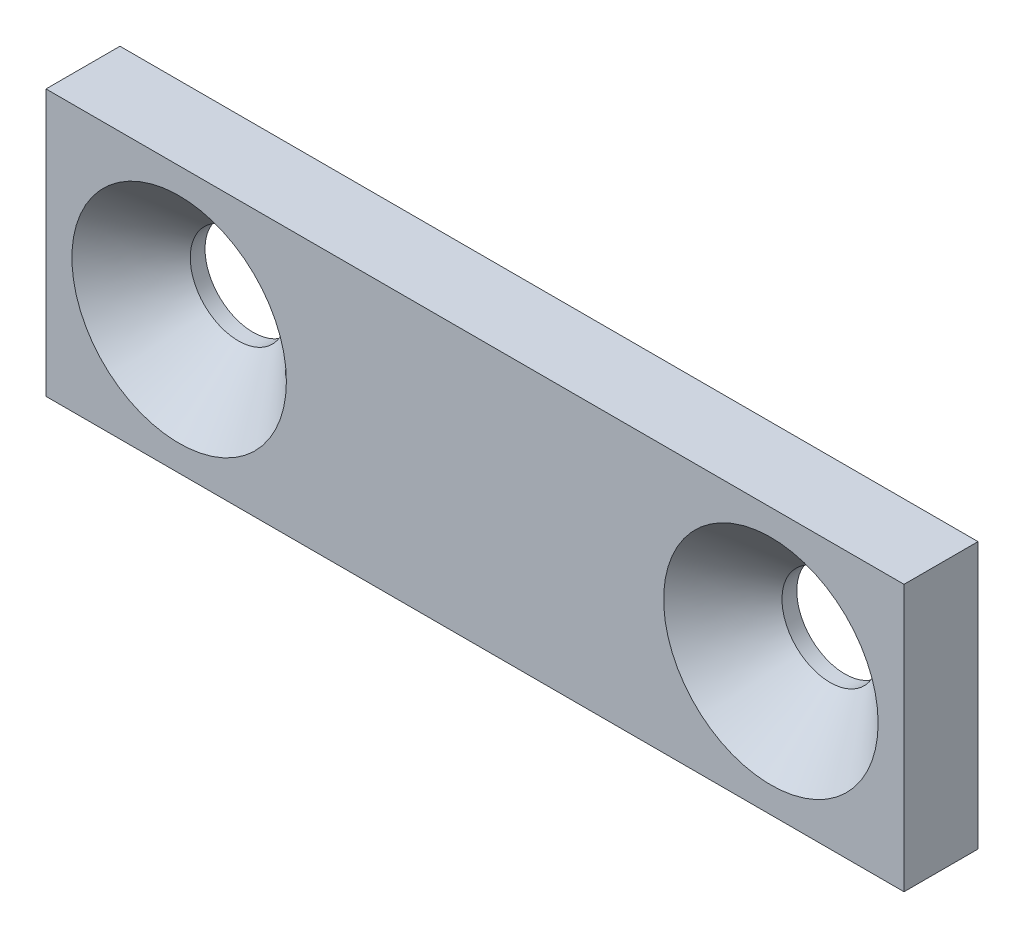
from build123d import *

# Parameters (mm, degrees)
ESQUISSE1_W                = 58
ESQUISSE1_H                = 18
BOSS_EXTRU_1_DEPTH         = 5
R_P_TITION_LIN_AIRE1_COUNT = 2
R_P_TITION_LIN_AIRE1_PITCH = 40


with BuildPart() as part:
    # Esquisse1 → Boss.-Extru.1 (new body)
    with BuildSketch(Plane.XY):
        Rectangle(ESQUISSE1_W, ESQUISSE1_H)
    extrude(amount=BOSS_EXTRU_1_DEPTH)

    # Esquisse3 → Fraisage pour vis à tête fraisée à 6 pans creux M61 (revolve, cut)
    with BuildSketch(Plane(origin=(20, 0, 5), x_dir=(0, -1, 0), z_dir=(1, 0, 0))):
        Polygon((0, 0), (0, 5), (3.25, 5), (3.25, 4), (7.25, 0), align=None)
    fraisage_pour_vis_t_te_frais_e_6_pan = revolve(axis=Axis((20, 0, 11.35), (0, 0, -1)), mode=Mode.SUBTRACT)

    # Répétition linéaire1: Fraisage pour vis à tête fraisée à 6 pans creux M61 ×2
    with Locations(*[(-i * R_P_TITION_LIN_AIRE1_PITCH, 0, 0) for i in range(1, R_P_TITION_LIN_AIRE1_COUNT)]):
        add(fraisage_pour_vis_t_te_frais_e_6_pan, mode=Mode.SUBTRACT)


solid = part.part
